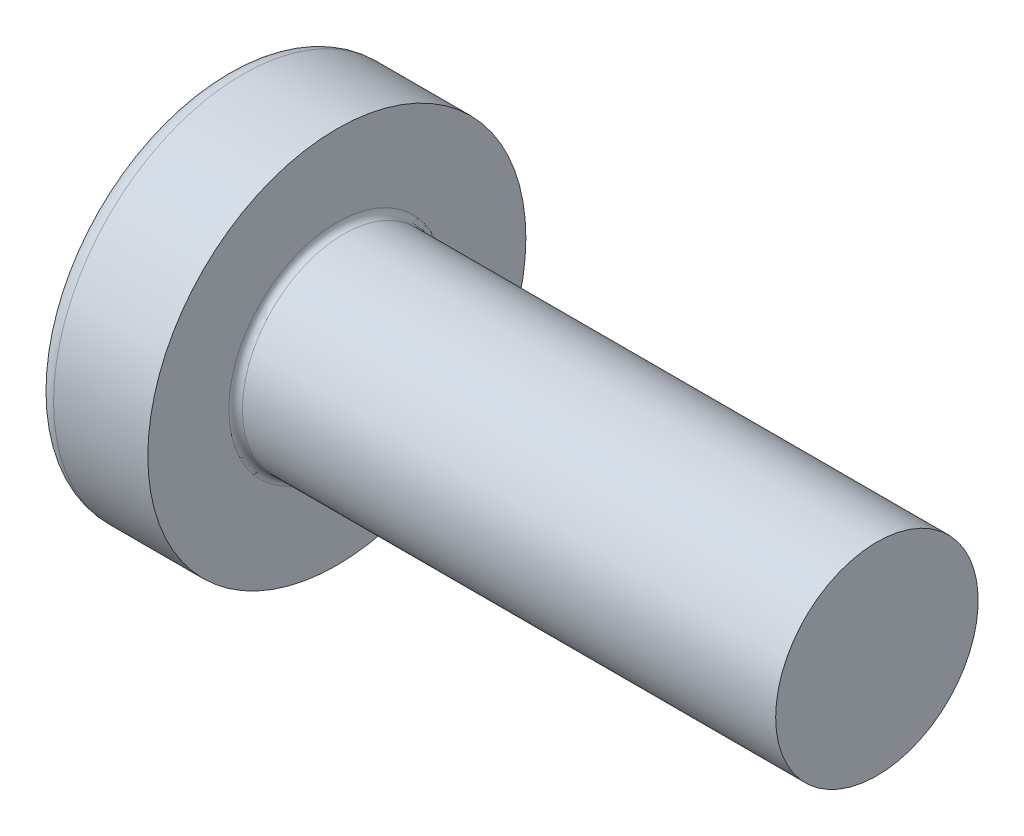
from build123d import *

# Parameters (mm, degrees)
FILLET1_R    = 0.1
RECPAT_COUNT = 2
RECPAT_ANGLE = 90


with BuildPart() as part:
    # BodySke → Base-Revolve (revolve)
    with BuildSketch(Plane.XY, mode=Mode.PRIVATE) as base_revolve_sk:
        with BuildLine():
            Line((2.4, 1.5), (2.4, 2.8))
            Line((2.4, 2.8), (1.003501533, 2.8))
            ThreePointArc((1.003501533, 2.8), (0.873295971, 2.76653015), (0.775371599, 2.674418605))
            ThreePointArc((0.775371599, 2.674418605), (0.197753546, 1.392274756), (0, 0))
            Line((0, 0), (10.4, 0))
            Line((10.4, 0), (10.4, 1.5))
            Line((10.4, 1.5), (2.4, 1.5))
        make_face()
    revolve(base_revolve_sk.sketch.rotate(Axis((1.003501533, 0, 0), (1, 0, 0)), 90), axis=Axis((1.003501533, 0, 0), (1, 0, 0)))

    # Fillet1
    fillet1_edges = [part.edges().sort_by_distance(p)[0] for p in [
        (2.4, 0, -1.5),
    ]]
    fillet(fillet1_edges, radius=FILLET1_R)

    # Sketch3 → Recess section 0
    with BuildSketch(Plane(origin=(0, 0, 0), x_dir=(0, 0, -1), z_dir=(1, 0, 0))):
        with BuildLine():
            Line((0.37, -1.4), (-0.37, -1.4))
            Line((-0.37, -1.4), (-0.37, 1.4))
            Line((-0.37, 1.4), (0.37, 1.4))
            Line((0.37, 1.4), (0.37, -1.4))
        make_face()
    # Sketch4 → Recess section 1
    with BuildSketch(Plane(origin=(1.75, 0, 0), x_dir=(0, 0, -1), z_dir=(1, 0, 0))):
        with BuildLine():
            Line((0.37, -0.527482332), (-0.37, -0.527482332))
            Line((-0.37, -0.527482332), (-0.37, 0.527482332))
            Line((-0.37, 0.527482332), (0.37, 0.527482332))
            Line((0.37, 0.527482332), (0.37, -0.527482332))
        make_face()
    recess = loft(mode=Mode.SUBTRACT)

    # RecPat: Recess ×2 about axis
    recpat_axis = Axis((0, 0, 0), (1, 0, 0))
    for i in range(1, RECPAT_COUNT):
        add(recess.rotate(recpat_axis, i * RECPAT_ANGLE / (RECPAT_COUNT - 1)), mode=Mode.SUBTRACT)

    # RecCorSke → RecessCore (revolve, cut)
    with BuildSketch(Plane.XY, mode=Mode.PRIVATE) as recesscore_sk:
        Polygon((0, 0), (0, 0.678371921), (1.75, 0.556), (1.930655351, 0), align=None)
    revolve(recesscore_sk.sketch.rotate(Axis((-3.175, 0, 0), (1, 0, 0)), 15.814025638), axis=Axis((-3.175, 0, 0), (1, 0, 0)), mode=Mode.SUBTRACT)


solid = part.part
